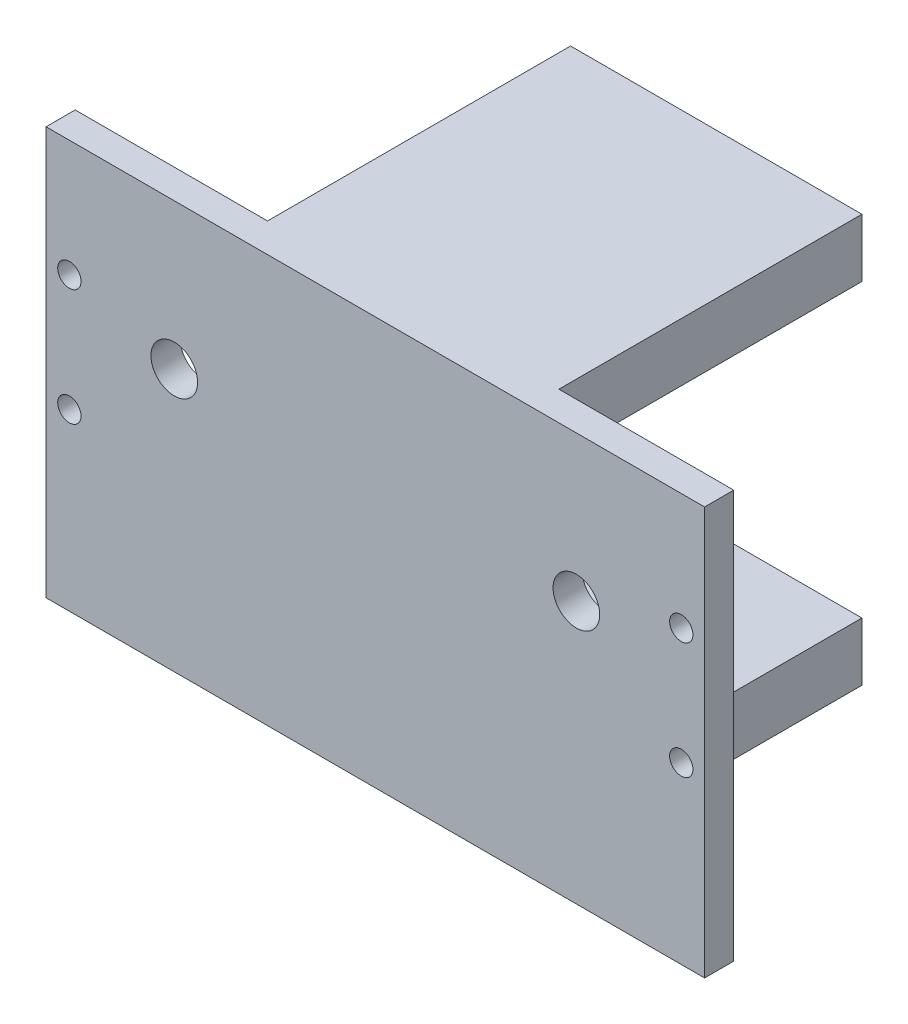
from build123d import *

# Parameters (mm, degrees)
SKETCH_1_W          = 113
SKETCH_1_H          = 70
EXTRUDE_1_DEPTH     = 5
SKETCH_2_W          = 50
SKETCH_2_H          = 10
EXTRUDE_2_DEPTH     = 52
SKETCH_3_R          = 4
CUT_EXTRUDE_1_DEPTH = 85.387499074
SKETCH_5_R          = 2
CUT_EXTRUDE_2_DEPTH = 88.55712421


with BuildPart() as part:
    # 草图1 → 凸台-拉伸1 (new body)
    with BuildSketch(Plane.XY):
        Rectangle(SKETCH_1_W, SKETCH_1_H)
    extrude(amount=EXTRUDE_1_DEPTH)

    # 草图2 → 凸台-拉伸2 (add)
    with BuildSketch(Plane(origin=(0, 0, 0), x_dir=(-1, 0, 0), z_dir=(0, 0, -1))):
        with Locations((-1.5, -30)):
            Rectangle(SKETCH_2_W, SKETCH_2_H)
        with Locations((-1.5, 30)):
            Rectangle(SKETCH_2_W, SKETCH_2_H)
    extrude(amount=EXTRUDE_2_DEPTH)

    # 草图3 → 切除-拉伸1 (cut, through all)
    with BuildSketch(Plane(origin=(0, 0, 0), x_dir=(-1, 0, 0), z_dir=(0, 0, -1))):
        with Locations((-34.5, 10)):
            Circle(SKETCH_3_R)
        with Locations((34.5, 10)):
            Circle(SKETCH_3_R)
    extrude(amount=-CUT_EXTRUDE_1_DEPTH, mode=Mode.SUBTRACT)

    # 草图5 → 切除-拉伸2 (cut, through all)
    with BuildSketch(Plane.XY.offset(5)):
        with Locations((-52.5, 15)):
            Circle(SKETCH_5_R)
        with Locations((52.5, 15)):
            Circle(SKETCH_5_R)
        with Locations((52.5, -5)):
            Circle(SKETCH_5_R)
        with Locations((-52.5, -5)):
            Circle(SKETCH_5_R)
    extrude(amount=-CUT_EXTRUDE_2_DEPTH, mode=Mode.SUBTRACT)


solid = part.part
